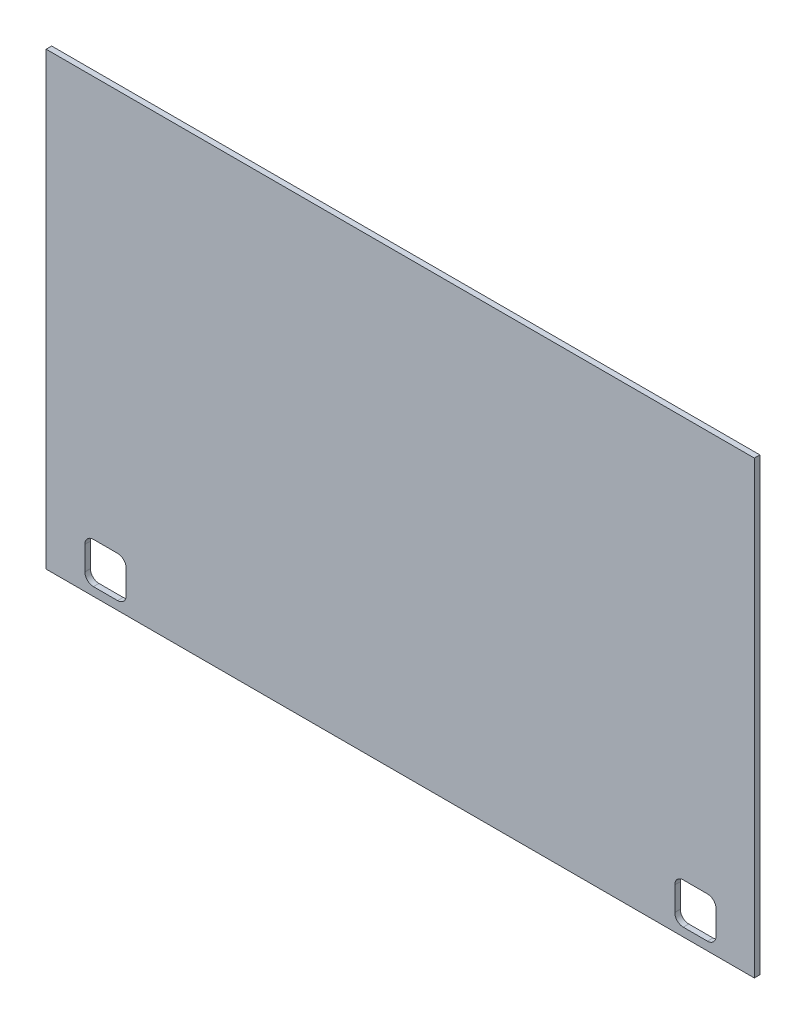
from build123d import *

# Parameters (mm, degrees)
ESQUISSE1_W                = 832
ESQUISSE1_H                = 529
BOSS_EXTRU_1_DEPTH         = 6.5
ENL_V_MAT_EXTRU_1_DEPTH    = 494.009634794
R_P_TITION_LIN_AIRE1_COUNT = 2
R_P_TITION_LIN_AIRE1_PITCH = 693


with BuildPart() as part:
    # Esquisse1 → Boss.-Extru.1 (new body)
    with BuildSketch(Plane.XY):
        Rectangle(ESQUISSE1_W, ESQUISSE1_H)
    extrude(amount=BOSS_EXTRU_1_DEPTH)

    # Esquisse2 → Enlèv. mat.-Extru.1 (cut, through all)
    with BuildSketch(Plane(origin=(0, 0, 0), x_dir=(-1, 0, 0), z_dir=(0, 0, -1))):
        with BuildLine():
            Line((-361, -254.521350197), (-332.52602316, -254.521350197))
            ThreePointArc((-332.52602316, -254.521350197), (-325.454955349, -251.592418009), (-322.52602316, -244.521350197))
            Line((-322.52602316, -244.521350197), (-322.52602316, -216.475228476))
            ThreePointArc((-322.52602316, -216.475228476), (-325.454955349, -209.404160664), (-332.52602316, -206.475228476))
            Line((-332.52602316, -206.475228476), (-361, -206.475228476))
            ThreePointArc((-361, -206.475228476), (-368.071067812, -209.404160664), (-371, -216.475228476))
            Line((-371, -216.475228476), (-371, -244.521350197))
            ThreePointArc((-371, -244.521350197), (-368.071067812, -251.592418009), (-361, -254.521350197))
        make_face()
    enl_v_mat_extru_1 = extrude(amount=-ENL_V_MAT_EXTRU_1_DEPTH, mode=Mode.SUBTRACT)

    # Répétition linéaire1: Enlèv. mat.-Extru.1 ×2
    with Locations(*[(-i * R_P_TITION_LIN_AIRE1_PITCH, 0, 0) for i in range(1, R_P_TITION_LIN_AIRE1_COUNT)]):
        add(enl_v_mat_extru_1, mode=Mode.SUBTRACT)


solid = part.part
